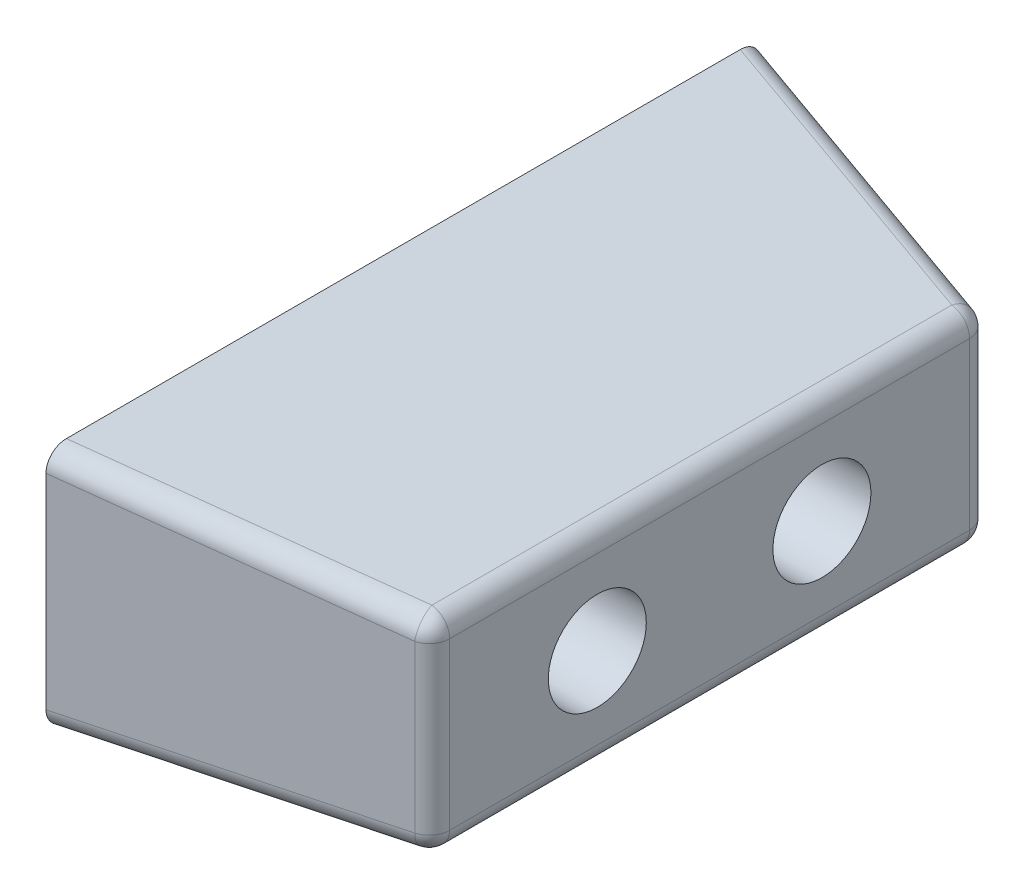
from build123d import *

# Parameters (mm, degrees)
EXTRUDE_1_DEPTH     = 87.5
CUT_EXTRUDE_1_DEPTH = 175
SKETCH_3_R          = 12
CUT_EXTRUDE_2_DEPTH = 52
SKETCH_4_R          = 5.5
CUT_EXTRUDE_3_DEPTH = 40
FILLET_1_R          = 5


with BuildPart() as part:
    # 草图1 → 凸台-拉伸1 (new, symmetric)
    with BuildSketch(Plane.XY):
        Polygon((0, 0), (0, 60), (75, 50), (75, 0), align=None)
    extrude(amount=EXTRUDE_1_DEPTH, both=True)

    # 草图2 → 切除-拉伸1 (cut)
    with BuildSketch(Plane.XZ):
        Polygon((0, 87.5), (75, 67.5), (75, 87.5), align=None)
        Polygon((0, -87.5), (75, -67.5), (75, -87.5), align=None)
    extrude(amount=-CUT_EXTRUDE_1_DEPTH, mode=Mode.SUBTRACT)

    # 草图3 → 切除-拉伸2 (cut)
    with BuildSketch(Plane(origin=(75, 0, 0), x_dir=(0, 0, -1), z_dir=(1, 0, 0))):
        with Locations((-27.5, 25)):
            Circle(SKETCH_3_R)
        with Locations((27.5, 25)):
            Circle(SKETCH_3_R)
    extrude(amount=-CUT_EXTRUDE_2_DEPTH, mode=Mode.SUBTRACT)

    # 草图4 → 切除-拉伸3 (cut)
    with BuildSketch(Plane(origin=(23, 0, 0), x_dir=(0, 0, -1), z_dir=(1, 0, 0))):
        with Locations((-27.5, 25)):
            Circle(SKETCH_4_R)
        with Locations((27.5, 25)):
            Circle(SKETCH_4_R)
    extrude(amount=-CUT_EXTRUDE_3_DEPTH, mode=Mode.SUBTRACT)

    # 圆角1
    fillet_1_edges = [part.edges().sort_by_distance(p)[0] for p in [
        (75, 50, 0),
        (75, 0, 0),
        (37.5, 55, 77.5),
        (75, 25, 67.5),
        (37.5, 0, 77.5),
        (75, 25, -67.5),
        (37.5, 55, -77.5),
        (37.5, 0, -77.5),
    ]]
    fillet(fillet_1_edges, radius=FILLET_1_R)


solid = part.part
